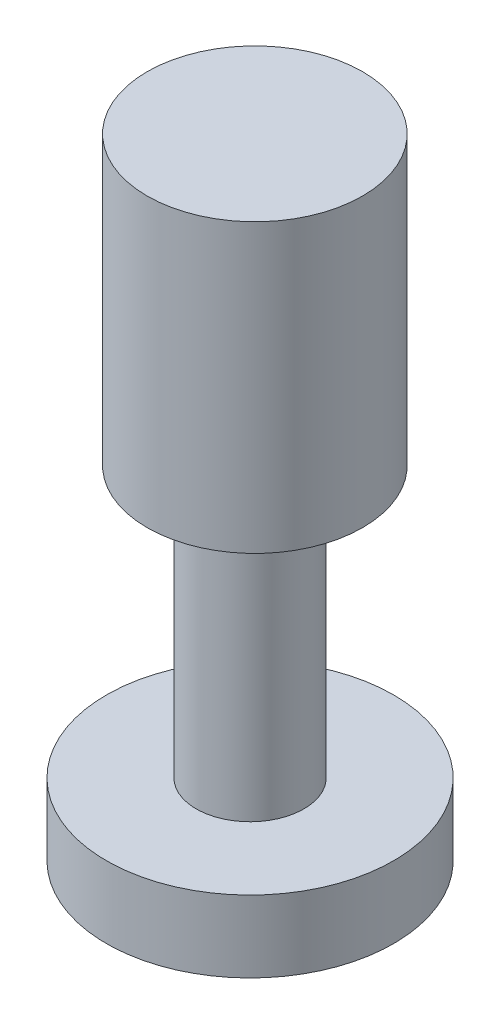
from build123d import *

# Parameters (mm, degrees)
SKETCH1_R           = 7.5
BOSS_EXTRUDE1_DEPTH = 38
SKETCH2_R           = 20
BOSS_EXTRUDE2_DEPTH = 10
SKETCH3_R           = 15
BOSS_EXTRUDE3_DEPTH = 40


with BuildPart() as part:
    # Sketch1 → Boss-Extrude1 (new body)
    with BuildSketch(Plane(origin=(0, 0, 0), x_dir=(1, 0, 0), z_dir=(0, 1, 0))):
        with Locations(Location((0, 0, 0), (0, 0, 270))):
            Circle(SKETCH1_R)
    extrude(amount=BOSS_EXTRUDE1_DEPTH)

    # Sketch2 → Boss-Extrude2 (add)
    with BuildSketch(Plane.XZ):
        with Locations(Location((0, 0, 0), (0, 0, 270))):
            Circle(SKETCH2_R)
    extrude(amount=BOSS_EXTRUDE2_DEPTH)

    # Sketch3 → Boss-Extrude3 (add)
    with BuildSketch(Plane(origin=(0, 38, 0), x_dir=(1, 0, 0), z_dir=(0, 1, 0))):
        with Locations(Location((0.670369296, 0, 0), (0, 0, 270))):
            Circle(SKETCH3_R)
    extrude(amount=BOSS_EXTRUDE3_DEPTH)


solid = part.part
